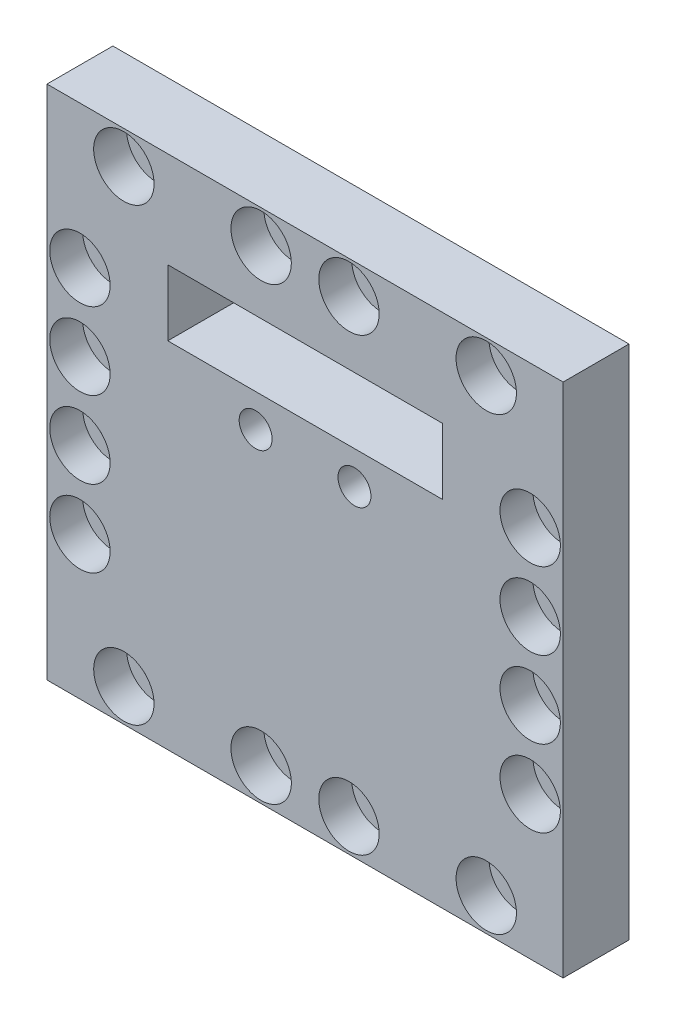
from build123d import *

# Parameters (mm, degrees)
SKETCH_1_W          = 94
SKETCH_1_H          = 94
SKETCH_1_R          = 3
SKETCH_1_W_2        = 50
SKETCH_1_H_2        = 12
EXTRUDE_1_DEPTH     = 12
SKETCH_2_R          = 5.5
CUT_EXTRUDE_1_DEPTH = 6


with BuildPart() as part:
    # 草图1 → 凸台-拉伸1 (new body)
    with BuildSketch(Plane.XY):
        Rectangle(SKETCH_1_W, SKETCH_1_H)
        with Locations((-33, 41)):
            Circle(SKETCH_1_R, mode=Mode.SUBTRACT)
        with Locations((-8, 41)):
            Circle(SKETCH_1_R, mode=Mode.SUBTRACT)
        with Locations((-41, 21)):
            Circle(SKETCH_1_R, mode=Mode.SUBTRACT)
        with Locations((-41, 7)):
            Circle(SKETCH_1_R, mode=Mode.SUBTRACT)
        with Locations((-41, -7)):
            Circle(SKETCH_1_R, mode=Mode.SUBTRACT)
        with Locations((-41, -21)):
            Circle(SKETCH_1_R, mode=Mode.SUBTRACT)
        with Locations(Location((-8, -41, 0), (0, 0, 180))):
            Circle(SKETCH_1_R, mode=Mode.SUBTRACT)
        with Locations(Location((-33, -41, 0), (0, 0, 180))):
            Circle(SKETCH_1_R, mode=Mode.SUBTRACT)
        with Locations((33, -41)):
            Circle(SKETCH_1_R, mode=Mode.SUBTRACT)
        with Locations((8, -41)):
            Circle(SKETCH_1_R, mode=Mode.SUBTRACT)
        with Locations(Location((41, -21, 0), (0, 0, 180))):
            Circle(SKETCH_1_R, mode=Mode.SUBTRACT)
        with Locations(Location((41, -7, 0), (0, 0, 180))):
            Circle(SKETCH_1_R, mode=Mode.SUBTRACT)
        with Locations(Location((41, 7, 0), (0, 0, 180))):
            Circle(SKETCH_1_R, mode=Mode.SUBTRACT)
        with Locations(Location((41, 21, 0), (0, 0, 180))):
            Circle(SKETCH_1_R, mode=Mode.SUBTRACT)
        with Locations(Location((8, 41, 0), (0, 0, 180))):
            Circle(SKETCH_1_R, mode=Mode.SUBTRACT)
        with Locations(Location((33, 41, 0), (0, 0, 180))):
            Circle(SKETCH_1_R, mode=Mode.SUBTRACT)
        with Locations((-9, 11.5)):
            Circle(SKETCH_1_R, mode=Mode.SUBTRACT)
        with Locations((9, 11.5)):
            Circle(SKETCH_1_R, mode=Mode.SUBTRACT)
        with Locations((0, 23.5)):
            Rectangle(SKETCH_1_W_2, SKETCH_1_H_2, mode=Mode.SUBTRACT)
    extrude(amount=EXTRUDE_1_DEPTH)

    # 草图2 → 切除-拉伸1 (cut)
    with BuildSketch(Plane.XY.offset(12)):
        with Locations((-33, 41)):
            Circle(SKETCH_2_R)
        with Locations((-8, 41)):
            Circle(SKETCH_2_R)
        with Locations((-41, 21)):
            Circle(SKETCH_2_R)
        with Locations(Location((41, 7, 0), (0, 0, 180))):
            Circle(SKETCH_2_R)
        with Locations((-41, 7)):
            Circle(SKETCH_2_R)
        with Locations(Location((41, 21, 0), (0, 0, 180))):
            Circle(SKETCH_2_R)
        with Locations(Location((8, 41, 0), (0, 0, 180))):
            Circle(SKETCH_2_R)
        with Locations(Location((33, 41, 0), (0, 0, 180))):
            Circle(SKETCH_2_R)
        with Locations((33, -41)):
            Circle(SKETCH_2_R)
        with Locations((8, -41)):
            Circle(SKETCH_2_R)
        with Locations((41, -21)):
            Circle(SKETCH_2_R)
        with Locations(Location((-41, -7, 0), (0, 0, 180))):
            Circle(SKETCH_2_R)
        with Locations((41, -7)):
            Circle(SKETCH_2_R)
        with Locations(Location((-41, -21, 0), (0, 0, 180))):
            Circle(SKETCH_2_R)
        with Locations(Location((-8, -41, 0), (0, 0, 180))):
            Circle(SKETCH_2_R)
        with Locations(Location((-33, -41, 0), (0, 0, 180))):
            Circle(SKETCH_2_R)
    extrude(amount=-CUT_EXTRUDE_1_DEPTH, mode=Mode.SUBTRACT)


solid = part.part
